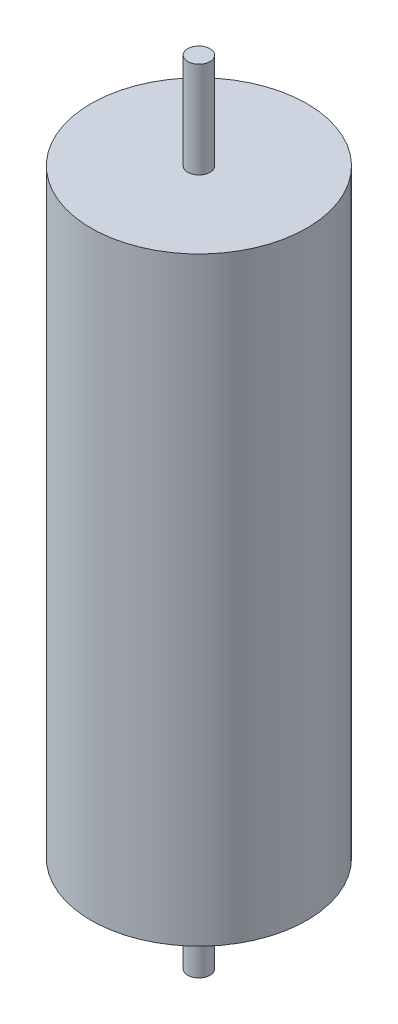
from build123d import *

# Parameters (mm, degrees)
SKETCH1_R           = 114.3
BOSS_EXTRUDE1_DEPTH = 317.5
SKETCH2_R           = 11.811
BOSS_EXTRUDE2_DEPTH = 101.6
BOSS_EXTRUDE3_START = 101.6
SKETCH3_R           = 11.811
BOSS_EXTRUDE3_DEPTH = 101.6


with BuildPart() as part:
    # Sketch1 → Boss-Extrude1 (new, symmetric)
    with BuildSketch(Plane(origin=(0, 0, 0), x_dir=(1, 0, 0), z_dir=(0, 1, 0))):
        with Locations(Location((0, 0, 0), (0, 0, 90))):
            Circle(SKETCH1_R)
    extrude(amount=BOSS_EXTRUDE1_DEPTH, both=True)

    # Sketch2 → Boss-Extrude2 (add)
    with BuildSketch(Plane(origin=(0, 317.5, 0), x_dir=(1, 0, 0), z_dir=(0, 1, 0))):
        with Locations(Location((0, 0, 0), (0, 0, 270))):
            Circle(SKETCH2_R)
    extrude(amount=BOSS_EXTRUDE2_DEPTH)

    # Sketch3 → Boss-Extrude3 (add)
    with BuildSketch(Plane.XZ.offset(317.5).offset(BOSS_EXTRUDE3_START)):
        with Locations(Location((0, 0, 0), (0, 0, 90))):
            Circle(SKETCH3_R)
    extrude(amount=-BOSS_EXTRUDE3_DEPTH)


solid = part.part
